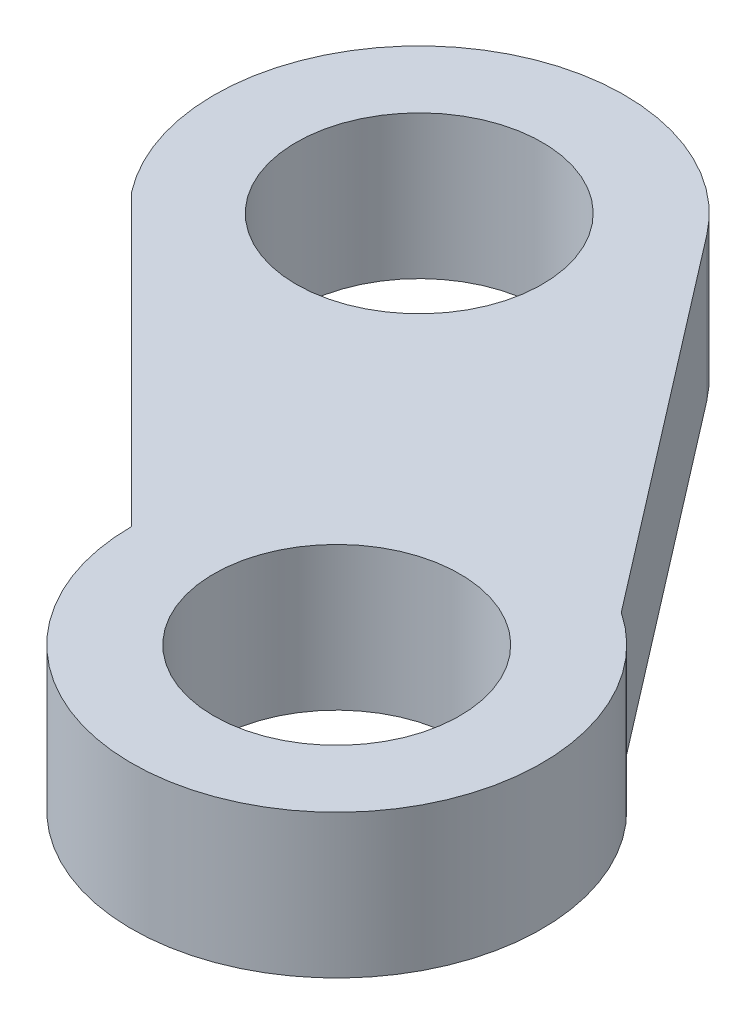
from build123d import *

# Parameters (mm, degrees)
SKETCH1_R           = 30
BOSS_EXTRUDE1_DEPTH = 35


with BuildPart() as part:
    # Sketch1 → Boss-Extrude1 (new body)
    with BuildSketch(Plane(origin=(0, 0, 0), x_dir=(1, 0, 0), z_dir=(0, 1, 0))):
        with BuildLine():
            Line((-111.539207578, 61.539207578), (-50, 0))
            ThreePointArc((-50, 0), (23.532123251, -44.116200826), (27.849567012, 41.525915008))
            Line((27.849567012, 41.525915008), (-41.425841319, 131.652573837))
            ThreePointArc((-41.425841319, 131.652573837), (-111.539207578, 140.824044377), (-120.710678119, 70.710678119))
            Line((-120.710678119, 70.710678119), (-111.539207578, 61.539207578))
        make_face()
        with Locations(Location((0, 0, 0), (0, 0, 270))):
            Circle(SKETCH1_R, mode=Mode.SUBTRACT)
        with Locations(Location((-81.068259719, 101.181625978, 0), (0, 0, 270))):
            Circle(SKETCH1_R, mode=Mode.SUBTRACT)
    extrude(amount=BOSS_EXTRUDE1_DEPTH)


solid = part.part
